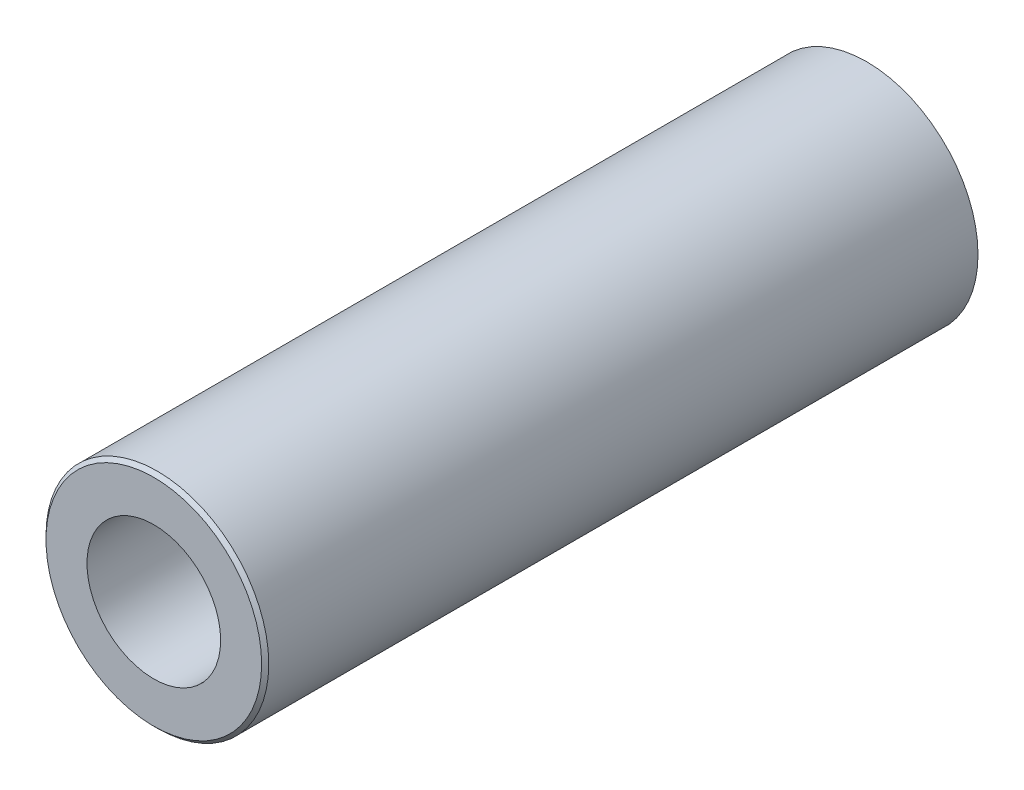
from build123d import *

# Parameters (mm, degrees)
SKETCH1_R                   = 7.9375
BOSS_EXTRUDE1_DEPTH         = 50.8
CHAMFER1_SIZE               = 0.254
F_5_16_0_3125_DOWEL_HOLE1_D = 9.525


with BuildPart() as part:
    # Sketch1 → Boss-Extrude1 (new body)
    with BuildSketch(Plane.XY):
        Circle(SKETCH1_R)
    extrude(amount=BOSS_EXTRUDE1_DEPTH)

    # Chamfer1
    chamfer1_edges = [part.edges().sort_by_distance(p)[0] for p in [
        (-7.9375, 0, 50.8),
    ]]
    chamfer(chamfer1_edges, length=CHAMFER1_SIZE)

    # 5/16 (0.3125) Dowel Hole1 (through all)
    with Locations(Plane.XY.offset(50.8)):
        with Locations((0, 0)):
            Hole(F_5_16_0_3125_DOWEL_HOLE1_D / 2)


solid = part.part
